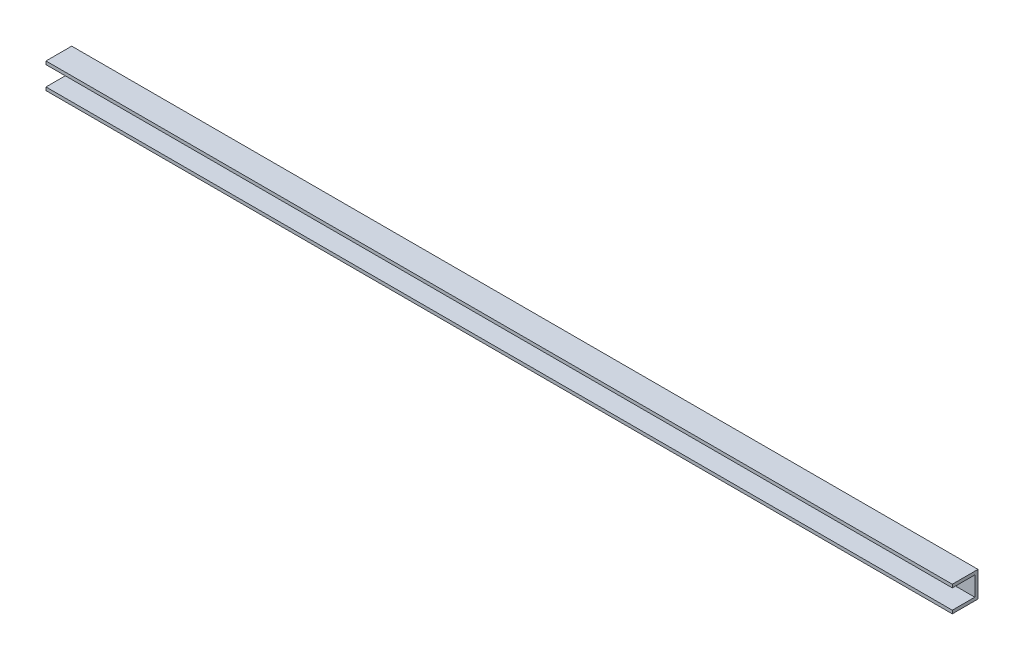
from build123d import *

# Parameters (mm, degrees)
BOSS_EXTRUDE2_DEPTH = 895.35


with BuildPart() as part:
    # Sketch1 → Boss-Extrude2 (new body)
    with BuildSketch(Plane(origin=(0, 0, 0), x_dir=(0, 0, -1), z_dir=(1, 0, 0))):
        Polygon((-29.575237151, 4.735075492), (-29.575237151, 1.560075492), (-7.350237151, 1.560075492), (-7.350237151, -17.489924508), (-29.575237151, -17.489924508), (-29.575237151, -20.664924508), (-4.175237151, -20.664924508), (-4.175237151, 4.735075492), align=None)
    extrude(amount=BOSS_EXTRUDE2_DEPTH)


solid = part.part
